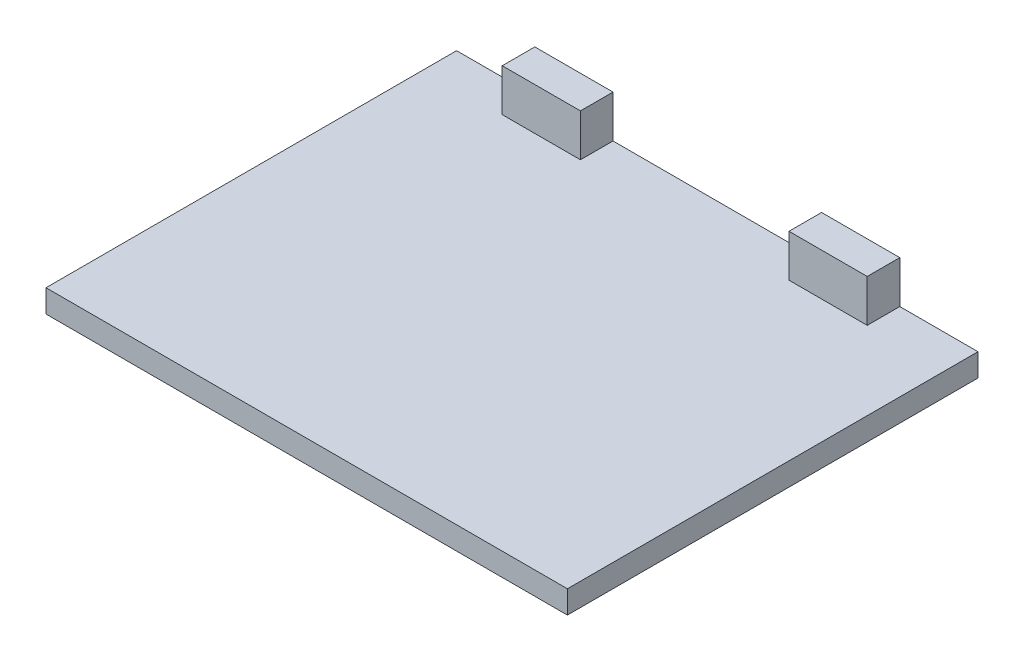
from build123d import *

# Parameters (mm, degrees)
SKETCH1_W           = 80
SKETCH1_H           = 58
BOSS_EXTRUDE1_DEPTH = 3.5
BOSS_EXTRUDE2_DEPTH = 5


with BuildPart() as part:
    # Sketch1 → Boss-Extrude1 (new body)
    with BuildSketch(Plane(origin=(0, 0, 0), x_dir=(1, 0, 0), z_dir=(0, 1, 0))):
        with Locations((40, 29)):
            Rectangle(SKETCH1_W, SKETCH1_H)
    extrude(amount=BOSS_EXTRUDE1_DEPTH)

    # Sketch2 → Boss-Extrude2 (add)
    with BuildSketch(Plane(origin=(0, 0, -58), x_dir=(-1, 0, 0), z_dir=(0, 0, -1))):
        Polygon((-68, 3.5), (-80, 3.5), (-80, 0), (0, 0), (0, 3.5), (-12, 3.5), (-12, 10), (-24, 10), (-24, 3.5), (-56, 3.5), (-56, 10), (-68, 10), align=None)
    extrude(amount=BOSS_EXTRUDE2_DEPTH)


solid = part.part
